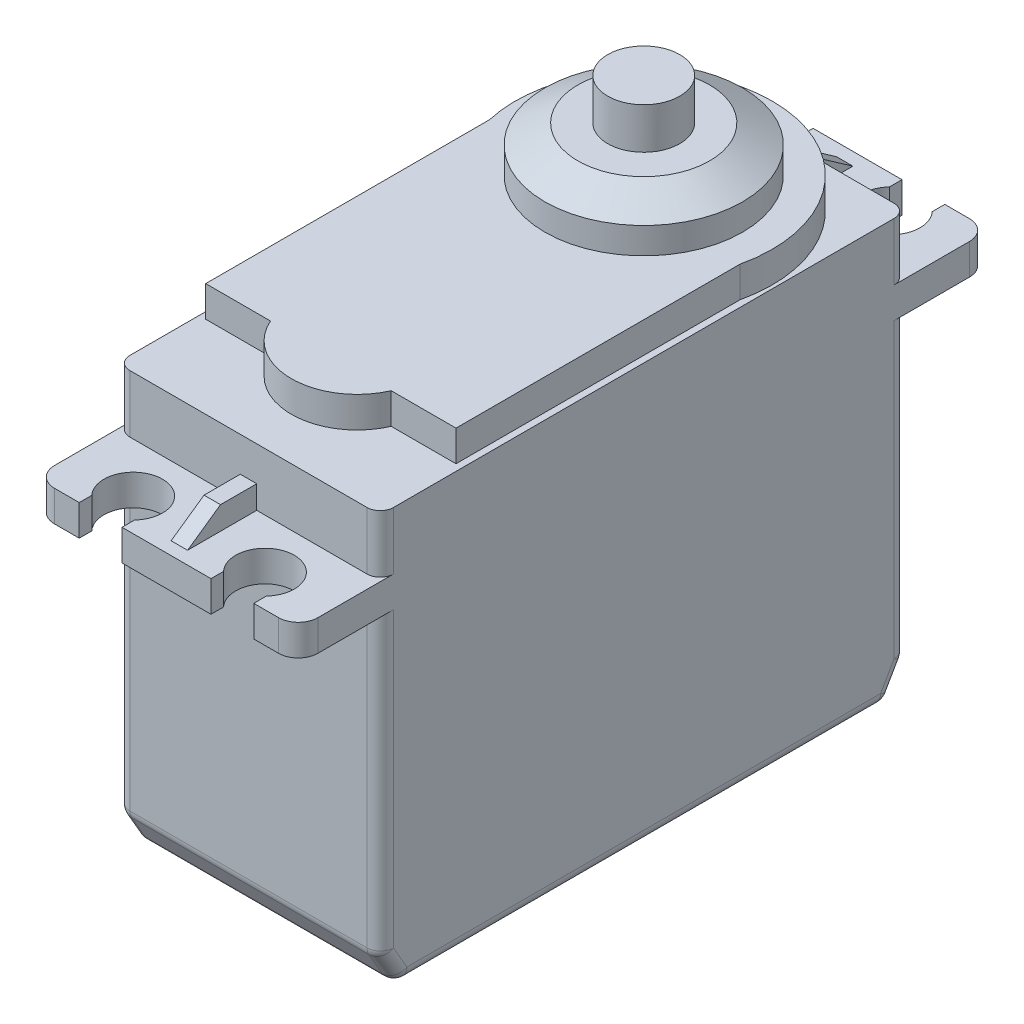
from build123d import *
from OCP.BRepFilletAPI import BRepFilletAPI_MakeChamfer

# Parameters (mm, degrees)
SKETCH1_W          = 20.32
SKETCH1_H          = 40.64
EXTRUDE1_DEPTH     = 25.4
SKETCH2_W          = 20.32
SKETCH2_H          = 40.64
EXTRUDE2_DEPTH     = 2.38125
SKETCH3_W          = 20.32
SKETCH3_H          = 40.64
EXTRUDE3_DEPTH     = 4.445
EXTRUDE4_DEPTH     = 2.38125
SKETCH5_R          = 7.62
EXTRUDE5_DEPTH     = 3.4925
CHAMFER1_SIZE      = 2.54
CHAMFER1_SIZE2     = 1.466469684
EXTRUDE6_DEPTH     = 0.635
SKETCH8_R          = 2.778125
EXTRUDE7_DEPTH     = 3.175
CHAMFER2_SIZE      = 2.54
CHAMFER2_SIZE2     = 1.466469684
FILLET1_R          = 1.016
FILLET2_R          = 1.524
SKETCH9_W          = 6.35
SKETCH9_H          = 2.54
EXTRUDE8_DEPTH     = 2.38125
SKETCH10_W         = 5.08
SKETCH10_H         = 1.27
CUT_EXTRUDE1_DEPTH = 2.38125


with BuildPart() as part:
    # Sketch1 → Extrude1 (new body)
    with BuildSketch(Plane(origin=(0, 0, 0), x_dir=(1, 0, 0), z_dir=(0, 1, 0))):
        with Locations((0, -10.16)):
            Rectangle(SKETCH1_W, SKETCH1_H)
    extrude(amount=EXTRUDE1_DEPTH)

    # Sketch2 → Extrude2 (add)
    with BuildSketch(Plane(origin=(0, 25.4, 0), x_dir=(-1, 0, 0), z_dir=(0, 1, 0))):
        with Locations((0, 10.16)):
            Rectangle(SKETCH2_W, SKETCH2_H)
        with BuildLine():
            ThreePointArc((6.731, -15.51418631), (5.08, -11.7094), (3.429, -15.51418631))
            Line((3.429, -15.51418631), (3.429, -16.4846))
            Line((3.429, -16.4846), (-3.429, -16.4846))
            Line((-3.429, -16.4846), (-3.429, -15.51418631))
            ThreePointArc((-3.429, -15.51418631), (-5.08, -11.7094), (-6.731, -15.51418631))
            Line((-6.731, -15.51418631), (-6.731, -16.4846))
            Line((-6.731, -16.4846), (-10.16, -16.4846))
            Line((-10.16, -16.4846), (-10.16, -10.16))
            Line((-10.16, -10.16), (10.16, -10.16))
            Line((10.16, -10.16), (10.16, -16.4846))
            Line((10.16, -16.4846), (6.731, -16.4846))
            Line((6.731, -16.4846), (6.731, -15.51418631))
        make_face()
        with BuildLine():
            ThreePointArc((-6.731, 35.83418631), (-5.08, 32.0294), (-3.429, 35.83418631))
            Line((-3.429, 35.83418631), (-3.429, 36.8046))
            Line((-3.429, 36.8046), (3.429, 36.8046))
            Line((3.429, 36.8046), (3.429, 35.83418631))
            ThreePointArc((3.429, 35.83418631), (5.08, 32.0294), (6.731, 35.83418631))
            Line((6.731, 35.83418631), (6.731, 36.8046))
            Line((6.731, 36.8046), (10.16, 36.8046))
            Line((10.16, 36.8046), (10.16, 30.48))
            Line((10.16, 30.48), (-10.16, 30.48))
            Line((-10.16, 30.48), (-10.16, 36.8046))
            Line((-10.16, 36.8046), (-6.731, 36.8046))
            Line((-6.731, 36.8046), (-6.731, 35.83418631))
        make_face()
    extrude(amount=EXTRUDE2_DEPTH)

    # Sketch3 → Extrude3 (add)
    with BuildSketch(Plane(origin=(0, 27.78125, 0), x_dir=(-1, 0, 0), z_dir=(0, 1, 0))):
        with Locations((0, 10.16)):
            Rectangle(SKETCH3_W, SKETCH3_H)
    extrude(amount=EXTRUDE3_DEPTH)

    # Sketch4 → Extrude4 (add)
    with BuildSketch(Plane(origin=(0, 32.22625, 0), x_dir=(-1, 0, 0), z_dir=(0, 1, 0))):
        with BuildLine():
            Line((9.652, 2.228840954), (9.652, 24.13))
            Line((9.652, 24.13), (4.655896906, 24.13))
            ThreePointArc((4.655896906, 24.13), (0, 27.178), (-4.655896906, 24.13))
            Line((-4.655896906, 24.13), (-9.652, 24.13))
            Line((-9.652, 24.13), (-9.652, 2.228840954))
            ThreePointArc((-9.652, 2.228840954), (0, -9.906), (9.652, 2.228840954))
        make_face()
    extrude(amount=EXTRUDE4_DEPTH)

    # Sketch5 → Extrude5 (add)
    with BuildSketch(Plane(origin=(0, 34.6075, 0), x_dir=(-1, 0, 0), z_dir=(0, 1, 0))):
        with Locations(Location((0, 0, 0), (0, 0, 270))):
            Circle(SKETCH5_R)
    extrude(amount=EXTRUDE5_DEPTH)

    # Chamfer1
    chamfer1_edges = [part.edges().sort_by_distance(p)[0] for p in [
        (0, 38.1, 7.62),
    ]]
    chamfer1_side = [part.faces().sort_by_distance(p)[0] for p in [
        (0, 38.1, 0),
    ]]
    chamfer(chamfer1_edges, length=CHAMFER1_SIZE, length2=CHAMFER1_SIZE2, reference=chamfer1_side[0])

    # Sketch7 → Extrude6 (add, symmetric)
    with BuildSketch(Plane(origin=(0, 0, 0), x_dir=(0, 0, -1), z_dir=(1, 0, 0))):
        Polygon((15.494, 27.78125), (12.954, 29.55925), (10.16, 29.55925), (10.16, 27.78125), align=None)
    extrude6 = extrude(amount=EXTRUDE6_DEPTH, both=True)

    # Mirror1: Extrude6 across plane
    add(extrude6.mirror(Plane(origin=(0, 0, 10.16), x_dir=(1, 0, 0), z_dir=(0, 0, -1))))

    # Sketch8 → Extrude7 (add)
    with BuildSketch(Plane(origin=(0, 38.1, 0), x_dir=(-1, 0, 0), z_dir=(0, 1, 0))):
        with Locations(Location((0, 0, 0), (0, 0, 270))):
            Circle(SKETCH8_R)
    extrude(amount=EXTRUDE7_DEPTH)

    # Chamfer2: one chamfer whose edges measure the first distance from different faces: ONE call of the kernel's chamfer builder (chamfer() names one face for all edges)
    chamfer2_edges_1 = [part.edges().sort_by_distance(p)[0] for p in [
        (0, 0, -10.16),
    ]]
    chamfer2_side_1 = [part.faces().sort_by_distance(p)[0] for p in [
        (0, 12.7, -10.16),
    ]]
    chamfer2_edges_2 = [part.edges().sort_by_distance(p)[0] for p in [
        (0, 0, 30.48),
    ]]
    chamfer2_side_2 = [part.faces().sort_by_distance(p)[0] for p in [
        (0, 12.7, 30.48),
    ]]
    chamfer2 = BRepFilletAPI_MakeChamfer(part.part.solid().wrapped)
    for e in chamfer2_edges_1:
        chamfer2.Add(CHAMFER2_SIZE, CHAMFER2_SIZE2, e.wrapped, chamfer2_side_1[0].wrapped)  # the first distance lies on this face
    for e in chamfer2_edges_2:
        chamfer2.Add(CHAMFER2_SIZE, CHAMFER2_SIZE2, e.wrapped, chamfer2_side_2[0].wrapped)  # the first distance lies on this face
    add(Compound.cast(chamfer2.Shape()), mode=Mode.REPLACE)

    # Fillet1
    fillet1_edges = [part.edges().sort_by_distance(p)[0] for p in [
        (-10.16, 30.00375, -10.16),
        (10.16, 30.00375, -10.16),
        (10.16, 30.00375, 30.48),
        (10.16, 0, 10.16),
        (10.16, 1.27, -9.426765158),
        (10.16, 13.97, -10.16),
        (0, 0, -8.693530316),
        (0, 2.54, -10.16),
        (-10.16, 13.97, -10.16),
        (-10.16, 1.27, -9.426765158),
        (10.16, 13.97, 30.48),
        (10.16, 1.27, 29.746765158),
        (0, 2.54, 30.48),
        (-10.16, 0, 10.16),
        (0, 0, 29.013530316),
        (-10.16, 1.27, 29.746765158),
        (-10.16, 13.97, 30.48),
        (-10.16, 30.00375, 30.48),
    ]]
    fillet(fillet1_edges, radius=FILLET1_R)

    # Fillet2
    fillet2_edges = [part.edges().sort_by_distance(p)[0] for p in [
        (-10.16, 26.590625, 36.8046),
        (10.16, 26.590625, 36.8046),
        (-10.16, 26.590625, -16.4846),
        (10.16, 26.590625, -16.4846),
    ]]
    fillet(fillet2_edges, radius=FILLET2_R)

    # Sketch9 → Extrude8 (add)
    with BuildSketch(Plane(origin=(0, 0, -10.16), x_dir=(-1, 0, 0), z_dir=(0, 0, -1))):
        with Locations((0, 4.318)):
            Rectangle(SKETCH9_W, SKETCH9_H)
    extrude(amount=EXTRUDE8_DEPTH)

    # Sketch10 → Cut-Extrude1 (cut)
    with BuildSketch(Plane(origin=(0, 0, -12.54125), x_dir=(-1, 0, 0), z_dir=(0, 0, -1))):
        with Locations((0, 4.318)):
            Rectangle(SKETCH10_W, SKETCH10_H)
    extrude(amount=-CUT_EXTRUDE1_DEPTH, mode=Mode.SUBTRACT)


solid = part.part
